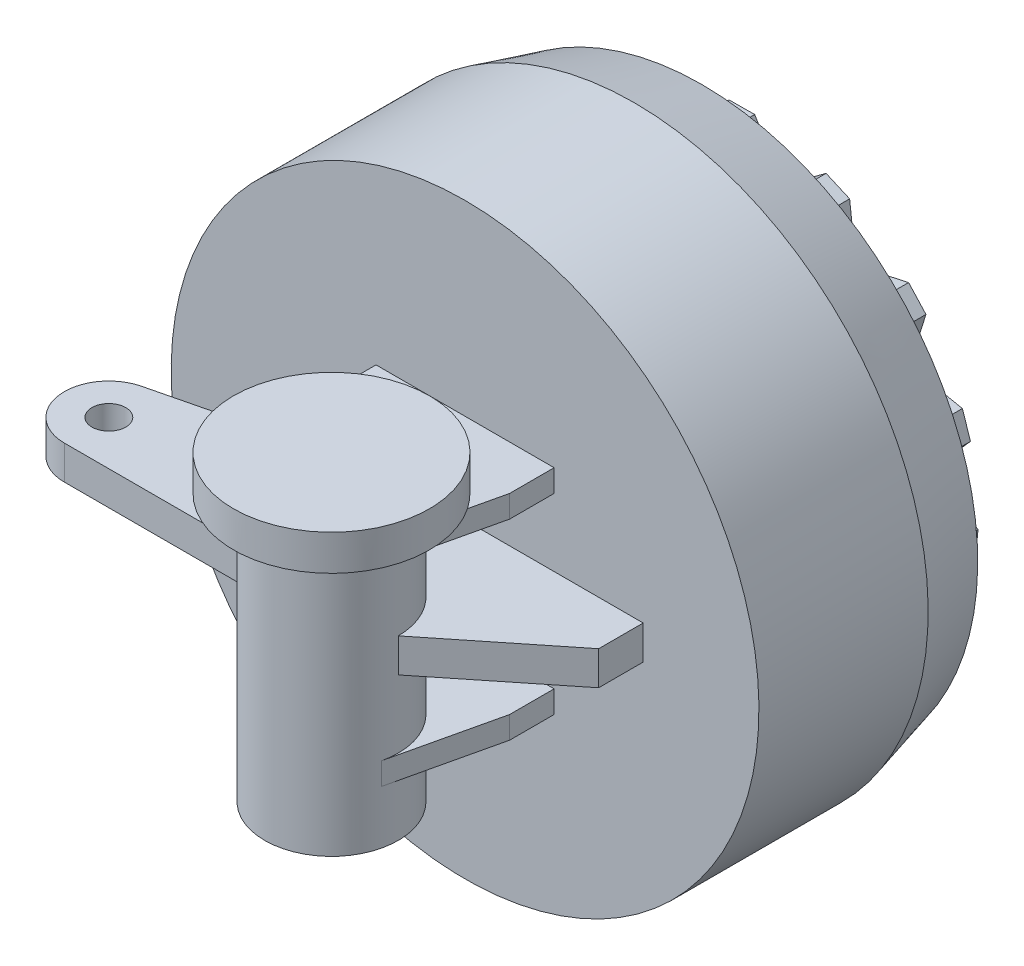
from build123d import *

# Parameters (mm, degrees)
CHAMFER1_SIZE            = 4
FILLET1_R                = 3.5
BOSS_EXTRUDE1_DEPTH      = 80
BOSS_EXTRUDE1_DEPTH_BACK = 90
SKETCH3_R                = 37.5
BOSS_EXTRUDE2_START      = 60
BOSS_EXTRUDE2_DEPTH      = 12.5
SKETCH5_R                = 9.5
BOSS_EXTRUDE3_DEPTH      = 9.5
SKETCH6_R                = 55
BOSS_EXTRUDE4_DEPTH      = 20
SKETCH7_R                = 7.5
BOSS_EXTRUDE5_DEPTH      = 25
BOSS_EXTRUDE6_START      = 10
SKETCH7_3_R              = 7.5
BOSS_EXTRUDE6_DEPTH      = 12.5
CIRPATTERN1_COUNT        = 15


with BuildPart() as part:
    # Sketch2 → Revolve1 (revolve)
    with BuildSketch(Plane(origin=(0, 0, 0), x_dir=(0, 0, -1), z_dir=(1, 0, 0))):
        Polygon((0, 0), (0, 165), (95, 165), (133, 154.817930688), (133, 75), (158, 75), (158, 50), (183, 50), (183, 0), align=None)
    revolve(axis=Axis((0, 0, -183), (0, 0, 1)))

    # Chamfer1
    chamfer1_edges = [part.edges().sort_by_distance(p)[0] for p in [
        (0, -50, -183),
    ]]
    chamfer(chamfer1_edges, length=CHAMFER1_SIZE)

    # Fillet1
    fillet1_edges = [part.edges().sort_by_distance(p)[0] for p in [
        (0, -50, -158),
        (0, -75, -158),
    ]]
    fillet(fillet1_edges, radius=FILLET1_R)


with BuildPart() as body_2:
    # Sketch3 → Boss-Extrude1 (new, two sides: drawn at the far end of the back side and taken through both)
    with BuildSketch(Plane(origin=(0, 0, 0), x_dir=(1, 0, 0), z_dir=(0, 1, 0)).offset(-BOSS_EXTRUDE1_DEPTH_BACK)):
        with Locations(Location((0, -75, 0), (0, 0, 270))):
            Circle(SKETCH3_R)
    extrude(amount=BOSS_EXTRUDE1_DEPTH + BOSS_EXTRUDE1_DEPTH_BACK)


with BuildPart() as body_3:
    # Sketch4 → Boss-Extrude2 (new body)
    with BuildSketch(Plane(origin=(0, 0, 0), x_dir=(1, 0, 0), z_dir=(0, 1, 0)).offset(BOSS_EXTRUDE2_START)):
        Polygon((36.542960266, -83.417960266), (50, -25), (50, 0), (-50, 0), (-50, -25), (-36.542960266, -83.417960266), align=None)
    boss_extrude2 = extrude(amount=-BOSS_EXTRUDE2_DEPTH)


with BuildPart() as part_1:
    add(part.part)

    add(body_2.part)  # Mirror2 merges body 2
    # Mirror2: Boss-Extrude2 across plane
    add(boss_extrude2.mirror(Plane.ZX))

    # Sketch5 → Boss-Extrude3 (add, symmetric)
    with BuildSketch(Plane(origin=(0, 0, 0), x_dir=(1, 0, 0), z_dir=(0, 1, 0))):
        with BuildLine():
            ThreePointArc((37.5, -75), (0, -37.5), (-37.5, -75))
            Line((-37.5, -75), (-150, -75))
            ThreePointArc((-150, -75), (-174.822997079, -52.969649142), (-155.897247359, -25.705505282))
            Line((-155.897247359, -25.705505282), (-50, 0))
            Line((-50, 0), (100, 0))
            Line((100, 0), (100, -25))
            Line((100, -25), (37.5, -75))
        make_face()
        with Locations(Location((-150, -50, 0), (0, 0, 270))):
            Circle(SKETCH5_R, mode=Mode.SUBTRACT)
    extrude(amount=BOSS_EXTRUDE3_DEPTH, both=True)

    add(body_3.part)  # Boss-Extrude4 merges body 3
    # Sketch6 → Boss-Extrude4 (add)
    with BuildSketch(Plane(origin=(0, 60, 0), x_dir=(1, 0, 0), z_dir=(0, 1, 0))):
        with Locations(Location((0, -75, 0), (0, 0, 145.958125966))):
            Circle(SKETCH6_R)
    extrude(amount=BOSS_EXTRUDE4_DEPTH)

    # Sketch7 → Boss-Extrude5 (add)
    with BuildSketch(Plane(origin=(0, 0, -133), x_dir=(-1, 0, 0), z_dir=(0, 0, -1))):
        with Locations((0, 120)):
            Circle(SKETCH7_R)
    boss_extrude5 = extrude(amount=BOSS_EXTRUDE5_DEPTH)

    # Sketch7<3> → Boss-Extrude6 (add)
    with BuildSketch(Plane(origin=(0, 0, -133), x_dir=(-1, 0, 0), z_dir=(0, 0, -1)).offset(BOSS_EXTRUDE6_START)):
        Polygon((-7.122640171, 132.553936846), (-14.433348311, 120.108581093), (-7.310708141, 107.554644247), (7.122640171, 107.446063154), (14.433348311, 119.891418907), (7.310708141, 132.445355753), align=None)
        with Locations((0, 120)):
            Circle(SKETCH7_3_R, mode=Mode.SUBTRACT)
    boss_extrude6 = extrude(amount=BOSS_EXTRUDE6_DEPTH)

    # CirPattern1: Boss-Extrude5, Boss-Extrude6 ×15 about axis
    cirpattern1_axis = Axis((0, 0, 0), (0, 0, 1))
    add([boss_extrude5.rotate(cirpattern1_axis, i * 360 / CIRPATTERN1_COUNT) for i in range(1, CIRPATTERN1_COUNT)])
    add([boss_extrude6.rotate(cirpattern1_axis, i * 360 / CIRPATTERN1_COUNT) for i in range(1, CIRPATTERN1_COUNT)])


solid = part_1.part
